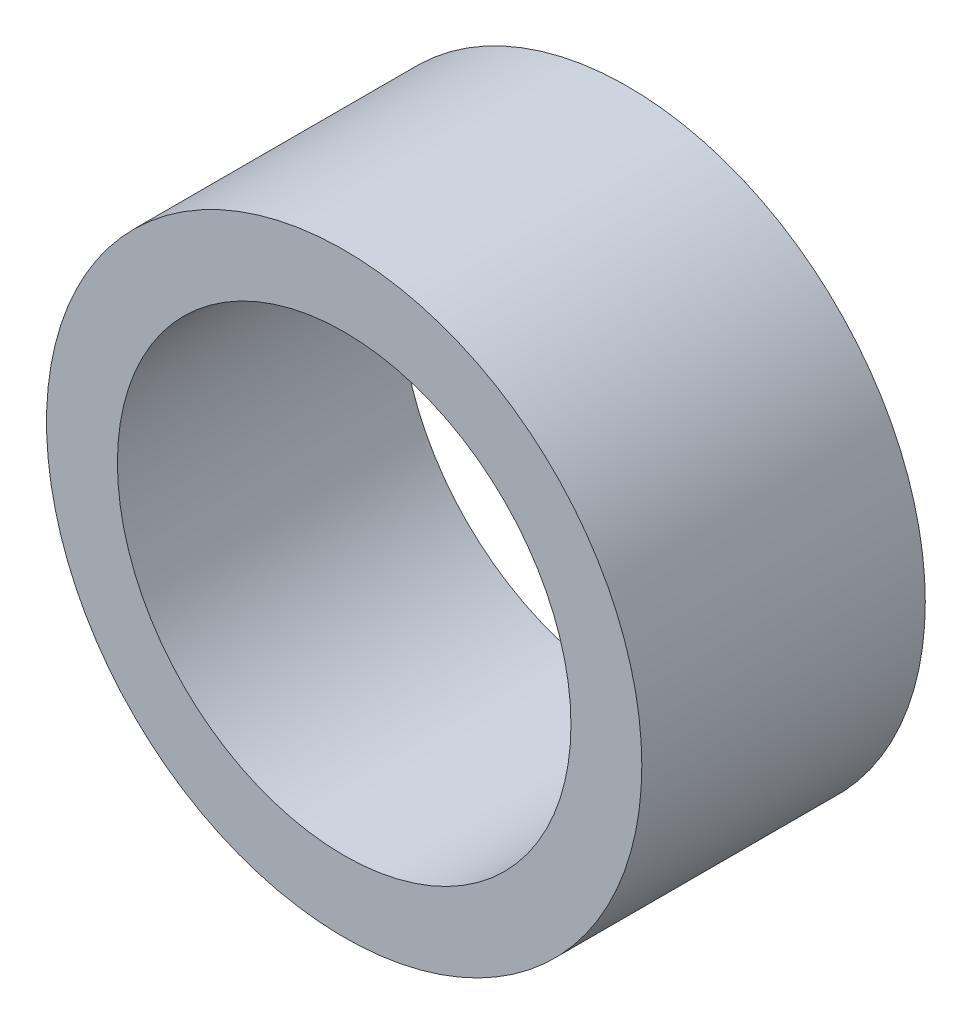
from build123d import *

# Parameters (mm, degrees)
SKETCH_1_R      = 5.25
SKETCH_1_R_2    = 4
EXTRUDE_1_DEPTH = 5


with BuildPart() as part:
    # 스케치1 → 보스-돌출1 (new body)
    with BuildSketch(Plane.XY):
        Circle(SKETCH_1_R)
        Circle(SKETCH_1_R_2, mode=Mode.SUBTRACT)
    extrude(amount=EXTRUDE_1_DEPTH)


solid = part.part
